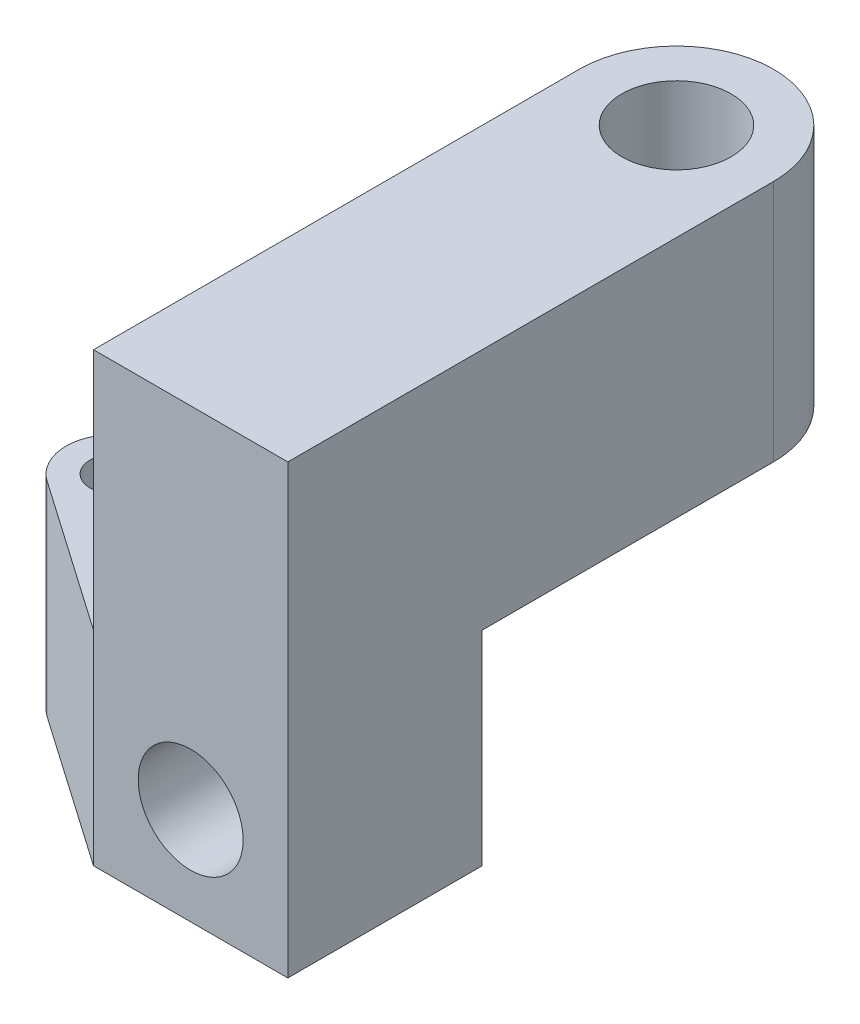
from build123d import *

# Parameters (mm, degrees)
BOSS_EXTRUDE4_DEPTH = 25.4
CUT_EXTRUDE1_REACH  = 35.668
SKETCH7_R           = 3.175
SKETCH9_W           = 14.069203901
SKETCH9_H           = 9.525
CUT_EXTRUDE2_DEPTH  = 25.4
SKETCH10_W          = 12.7
SKETCH10_H          = 9.525
BOSS_EXTRUDE5_DEPTH = 12.7
SKETCH11_R          = 1.5875
CUT_EXTRUDE3_DEPTH  = 12.7
SKETCH13_W          = 13.214088126
SKETCH13_H          = 21.166666667
CUT_EXTRUDE5_DEPTH  = 9.525
SKETCH14_W          = 12.7
SKETCH14_H          = 9.525
BOSS_EXTRUDE6_DEPTH = 12.7
CUT_EXTRUDE7_DEPTH  = 12.7
BOSS_EXTRUDE7_DEPTH = 9.525
SKETCH17_R          = 3.175
BOSS_EXTRUDE8_DEPTH = 15.875
SKETCH18_R          = 3.571875
CUT_EXTRUDE8_DEPTH  = 15.875
SKETCH19_R          = 1.587499998
CUT_EXTRUDE9_DEPTH  = 15.875
SKETCH20_R          = 1.587499998
BOSS_EXTRUDE9_DEPTH = 3.81
SKETCH21_R          = 3.429
CUT_EXTRUDE10_DEPTH = 12.7


with BuildPart() as part:
    # Sketch6 → Boss-Extrude4 (new body)
    with BuildSketch(Plane(origin=(0, 0, 0), x_dir=(1, 0, 0), z_dir=(0, 1, 0))):
        with BuildLine():
            Line((-6.35, -21.166666667), (6.35, -21.166666667))
            Line((6.35, -21.166666667), (6.35, 10.583333333))
            ThreePointArc((6.35, 10.583333333), (0, 16.933333333), (-6.35, 10.583333333))
            Line((-6.35, 10.583333333), (-6.35, -21.166666667))
        make_face()
    extrude(amount=BOSS_EXTRUDE4_DEPTH)

    # Sketch7 → Cut-Extrude1 (cut, up to next)
    with BuildSketch(Plane.XZ, mode=Mode.PRIVATE) as cut_extrude1_sk1:
        with Locations(Location((0, -10.583333333, 0), (0, 0, 270))):
            Circle(SKETCH7_R)
    cut_extrude1_tool1 = extrude(cut_extrude1_sk1.sketch, amount=-CUT_EXTRUDE1_REACH, mode=Mode.PRIVATE) & part.part
    add(cut_extrude1_tool1.solids().sort_by_distance((0, 0, -10.583333))[0], mode=Mode.SUBTRACT)

    # Sketch9 → Cut-Extrude2 (cut)
    with BuildSketch(Plane.XY.offset(-16.933333333)):
        with Locations((0.122145241, 4.7625)):
            Rectangle(SKETCH9_W, SKETCH9_H)
    extrude(amount=CUT_EXTRUDE2_DEPTH, mode=Mode.SUBTRACT)

    # Sketch10 → Boss-Extrude5 (add)
    with BuildSketch(Plane(origin=(6.35, 0, 0), x_dir=(0, 0, -1), z_dir=(1, 0, 0))):
        with Locations((-14.816666667, 4.7625)):
            Rectangle(SKETCH10_W, SKETCH10_H)
    extrude(amount=BOSS_EXTRUDE5_DEPTH)

    # Sketch11 → Cut-Extrude3 (cut)
    with BuildSketch(Plane(origin=(0, 9.525, 0), x_dir=(1, 0, 0), z_dir=(0, 1, 0))):
        with BuildLine():
            ThreePointArc((15.875, -8.466666667), (15.927897388, -8.467107348), (15.980780092, -8.468429271))
            ThreePointArc((15.980780092, -8.468429271), (18.157156523, -9.434318347), (19.05, -11.641666667))
            Line((19.05, -11.641666667), (19.05, -8.466666667))
            Line((19.05, -8.466666667), (15.875, -8.466666667))
        make_face()
        with BuildLine():
            Line((12.847839644, -12.599228768), (6.35, -21.166666667))
            Line((6.35, -21.166666667), (19.05, -21.166666667))
            Line((19.05, -21.166666667), (19.05, -11.641666667))
            ThreePointArc((19.05, -11.641666667), (16.359453749, -14.779489091), (12.847839644, -12.599228768))
        make_face()
        with Locations(Location((15.875, -11.641666667, 0), (0, 0, 270))):
            Circle(SKETCH11_R)
    extrude(amount=-CUT_EXTRUDE3_DEPTH, mode=Mode.SUBTRACT)

    # Sketch13 → Cut-Extrude5 (cut)
    with BuildSketch(Plane(origin=(0, 9.525, 0), x_dir=(1, 0, 0), z_dir=(0, 1, 0))):
        with Locations((12.957044063, -10.583333334)):
            Rectangle(SKETCH13_W, SKETCH13_H)
    extrude(amount=-CUT_EXTRUDE5_DEPTH, mode=Mode.SUBTRACT)

    # Sketch14 → Boss-Extrude6 (add)
    with BuildSketch(Plane.ZY.offset(6.35)):
        with Locations((14.816666667, 4.7625)):
            Rectangle(SKETCH14_W, SKETCH14_H)
    extrude(amount=BOSS_EXTRUDE6_DEPTH)

    # Sketch15 → Cut-Extrude7 (cut)
    with BuildSketch(Plane(origin=(0, 9.525, 0), x_dir=(1, 0, 0), z_dir=(0, 1, 0))):
        Polygon((-6.35, -8.466666667), (-14.506048031, -8.466666667), (-19.05, -8.466666667), (-19.05, -21.166666667), (-6.35, -21.166666667), align=None)
    extrude(amount=-CUT_EXTRUDE7_DEPTH, mode=Mode.SUBTRACT)

    # Sketch16 → Boss-Extrude7 (add)
    with BuildSketch(Plane(origin=(0, 9.525, 0), x_dir=(1, 0, 0), z_dir=(0, 1, 0))):
        Polygon((-17.681048031, -21.166666667), (-6.35, -21.166666667), (-6.35, -8.466666667), (-13.303781858, -8.466666667), (-17.681048031, -8.466666667), (-17.681048031, -11.641666667), align=None)
    extrude(amount=-BOSS_EXTRUDE7_DEPTH)

    # Sketch17 → Boss-Extrude8 (add)
    with BuildSketch(Plane.XZ.offset(-9.525)):
        with Locations((0, -10.583333333)):
            Circle(SKETCH17_R)
    extrude(amount=-BOSS_EXTRUDE8_DEPTH)

    # Sketch18 → Cut-Extrude8 (cut)
    with BuildSketch(Plane.XZ.offset(-9.525)):
        with Locations((0, -10.583333333)):
            Circle(SKETCH18_R)
    extrude(amount=-CUT_EXTRUDE8_DEPTH, mode=Mode.SUBTRACT)

    # Sketch19 → Cut-Extrude9 (cut)
    with BuildSketch(Plane(origin=(0, 9.525, 0), x_dir=(1, 0, 0), z_dir=(0, 1, 0))):
        with Locations(Location((-14.50604803, -11.641666664, 0), (0, 0, 270))):
            Circle(SKETCH19_R)
        with BuildLine():
            Line((-17.681048031, -8.466666667), (-14.50604803, -8.466666667))
            Line((-14.50604803, -8.466666667), (-14.50604803, -8.479366664))
            ThreePointArc((-14.50604803, -8.479366664), (-17.523471535, -10.695465482), (-16.311752542, -14.237735328))
            Line((-16.311752542, -14.237735328), (-6.35, -21.166666667))
            Line((-6.35, -21.166666667), (-17.681048031, -21.166666667))
            Line((-17.681048031, -21.166666667), (-17.681048031, -8.466666667))
        make_face()
    extrude(amount=-CUT_EXTRUDE9_DEPTH, mode=Mode.SUBTRACT)

    # Sketch20 → Boss-Extrude9 (add)
    with BuildSketch(Plane.XZ):
        with BuildLine():
            Line((-6.35, 21.166666667), (6.35, 21.166666667))
            Line((6.35, 21.166666667), (6.35, 8.466666667))
            Line((6.35, 8.466666667), (-14.50604803, 8.479366664))
            ThreePointArc((-14.50604803, 8.479366664), (-17.523471535, 10.695465482), (-16.311752542, 14.237735328))
            Line((-16.311752542, 14.237735328), (-6.35, 21.166666667))
        make_face()
        with Locations(Location((-14.50604803, 11.641666664, 0), (0, 0, 90))):
            Circle(SKETCH20_R, mode=Mode.SUBTRACT)
    extrude(amount=BOSS_EXTRUDE9_DEPTH)

    # Sketch21 → Cut-Extrude10 (cut)
    with BuildSketch(Plane.XY.offset(21.166666667)):
        with Locations((0, 2.54)):
            Circle(SKETCH21_R)
    extrude(amount=-CUT_EXTRUDE10_DEPTH, mode=Mode.SUBTRACT)


solid = part.part
